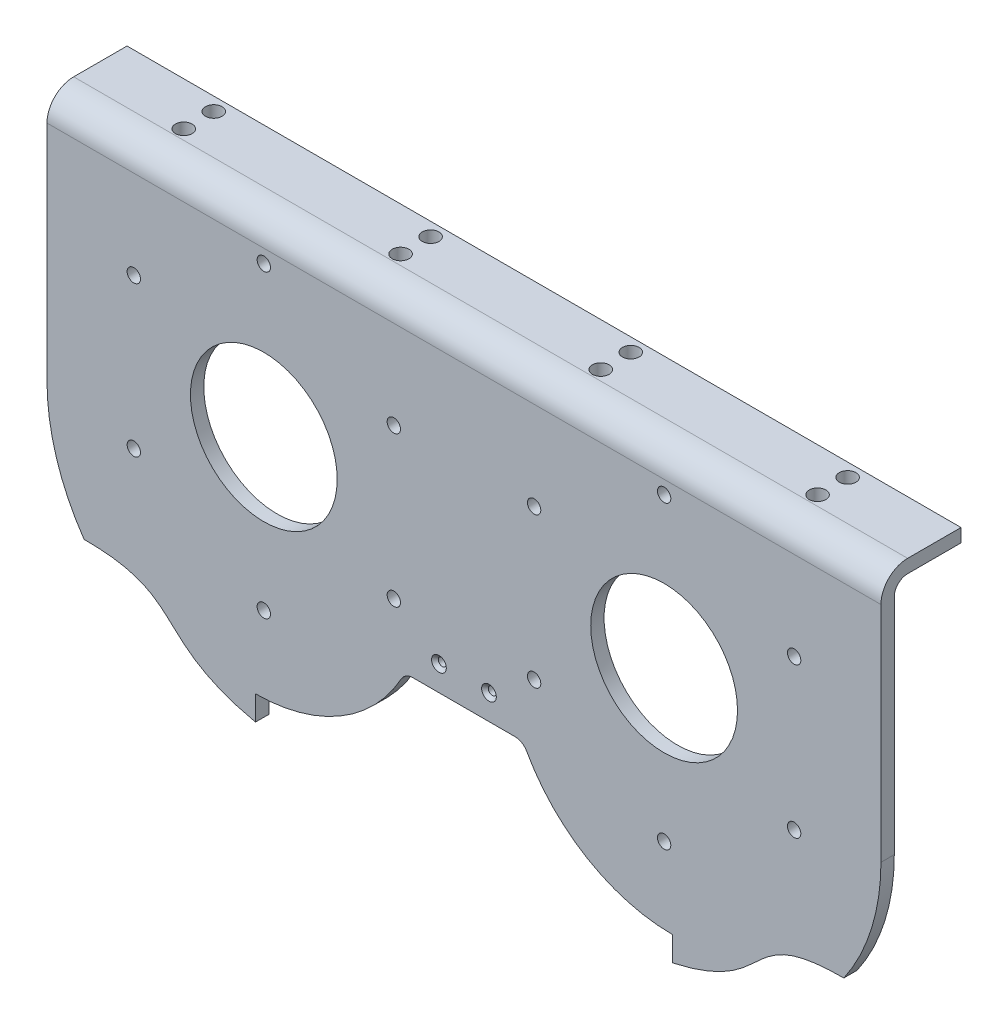
from build123d import *

# Parameters (mm, degrees)
SKETCH1_W                                           = 250
SKETCH1_H                                           = 155.2734375
BOSS_EXTRUDE1_DEPTH                                 = 4
FILLET1_R                                           = 62.5
CUT_EXTRUDE1_DEPTH                                  = 10
CUT_EXTRUDE2_DEPTH                                  = 10
SKETCH7_R                                           = 22
CUT_EXTRUDE3_DEPTH                                  = 7
SKETCH8_W                                           = 250
SKETCH8_H                                           = 19.85691045
CUT_EXTRUDE4_DEPTH                                  = 7
BOSS_EXTRUDE6_DEPTH                                 = 250
CUT_EXTRUDE6_DEPTH                                  = 250
CIRPATTERN1_COUNT                                   = 6
F_5_0_5_DIAMETER_HOLE2_AT_2_COUNT                   = 2
F_5_0_5_DIAMETER_HOLE2_AT_2_PITCH                   = 9
LPATTERN2_COUNT                                     = 2
LPATTERN2_PITCH                                     = 65
CSK_FOR_M2_COUNTERSUNK_FLAT_HEAD_SCREW1_D           = 2.4
CSK_FOR_M2_COUNTERSUNK_FLAT_HEAD_SCREW1_DEPTH       = 9
CSK_FOR_M2_COUNTERSUNK_FLAT_HEAD_SCREW1_CSINK_D     = 4.4
CSK_FOR_M2_COUNTERSUNK_FLAT_HEAD_SCREW1_CSINK_ANGLE = 90
CSK_FOR_M2_COUNTERSUNK_FLAT_HEAD_SCREW1_TIP         = 0.721032743


with BuildPart() as part:
    # Sketch1 → Boss-Extrude1 (new body)
    with BuildSketch(Plane.XY):
        with Locations((0, -2.7798083)):
            Rectangle(SKETCH1_W, SKETCH1_H)
    extrude(amount=BOSS_EXTRUDE1_DEPTH)

    # Fillet1
    fillet1_edges = [part.edges().sort_by_distance(p)[0] for p in [
        (125, -80.41652705, 2),
        (-125, -80.41652705, 2),
    ]]
    fillet(fillet1_edges, radius=FILLET1_R)

    # Sketch5 → Cut-Extrude1 (cut)
    with BuildSketch(Plane.XY.offset(4)):
        with BuildLine():
            Line((15.296531701, -40.14308955), (-15.296531701, -40.14308955))
            ThreePointArc((-15.296531701, -40.14308955), (-17.324975275, -40.695566285), (-18.793084909, -42.200381217))
            ThreePointArc((-18.793084909, -42.200381217), (-37.144455324, -61.01056787), (-62.5, -67.91652705))
            Line((-62.5, -67.91652705), (-62.5, -80.41652705))
            Line((-62.5, -80.41652705), (62.5, -80.41652705))
            Line((62.5, -80.41652705), (62.5, -67.91652705))
            ThreePointArc((62.5, -67.91652705), (37.144455324, -61.01056787), (18.793084909, -42.200381217))
            ThreePointArc((18.793084909, -42.200381217), (17.324975275, -40.695566285), (15.296531701, -40.14308955))
        make_face()
    extrude(amount=-CUT_EXTRUDE1_DEPTH, mode=Mode.SUBTRACT)

    # Sketch6 → Cut-Extrude2 (cut)
    with BuildSketch(Plane.XY.offset(4)):
        with BuildLine():
            Line((-113.871867123, -53.514016685), (-113.871867123, -84.736307966))
            Line((-113.871867123, -84.736307966), (-44.821444402, -84.736307966))
            Line((-44.821444402, -84.736307966), (-44.821444402, -77.864159797))
            add(Edge.make_bspline(
                [(-113.871867123, -53.514016685), (-77.935103041, -53.525535165), (-98.515305829, -73.080146865), (-44.821444402, -77.864159797)],
                knots=[0, 0, 0, 0, 1, 1, 1, 1], degree=3))
        make_face()
    cut_extrude2 = extrude(amount=-CUT_EXTRUDE2_DEPTH, mode=Mode.SUBTRACT)

    # Mirror2: Cut-Extrude2 across plane
    add(cut_extrude2.mirror(Plane(origin=(0, 0, 0), x_dir=(0, 0, 1), z_dir=(1, 0, 0))), mode=Mode.SUBTRACT)

    # Sketch7 → Cut-Extrude3 (cut)
    with BuildSketch(Plane.XY.offset(4)):
        with Locations((-60, 0)):
            Circle(SKETCH7_R)
    cut_extrude3 = extrude(amount=-CUT_EXTRUDE3_DEPTH, mode=Mode.SUBTRACT)

    # Mirror3: Cut-Extrude3 across plane
    add(cut_extrude3.mirror(Plane(origin=(0, 0, 0), x_dir=(0, 0, 1), z_dir=(1, 0, 0))), mode=Mode.SUBTRACT)

    # Sketch8 → Cut-Extrude4 (cut)
    with BuildSketch(Plane.XY.offset(4)):
        with Locations((0, 64.928455225)):
            Rectangle(SKETCH8_W, SKETCH8_H)
    extrude(amount=-CUT_EXTRUDE4_DEPTH, mode=Mode.SUBTRACT)

    # Sketch20 → Boss-Extrude6 (add)
    with BuildSketch(Plane.ZY.offset(125)):
        with BuildLine():
            Line((4, 45.281624312), (0, 45.281624312))
            Line((0, 45.281624312), (0, 49.00347295))
            ThreePointArc((0, 49.00347295), (-1.171572875, 51.831900074), (-4, 53.00347295))
            Line((-4, 53.00347295), (-20, 53.00347295))
            Line((-20, 53.00347295), (-20, 57.00347295))
            Line((-20, 57.00347295), (-4, 57.00347295))
            ThreePointArc((-4, 57.00347295), (1.656854249, 54.660327199), (4, 49.00347295))
            Line((4, 49.00347295), (4, 45.281624312))
        make_face()
    extrude(amount=-BOSS_EXTRUDE6_DEPTH)

    # Sketch22 → Cut-Extrude6 (cut)
    with BuildSketch(Plane.ZY.offset(125)):
        with BuildLine():
            Line((1.295437974, 55), (4, 55))
            Line((4, 55), (4, 49.00347295))
            ThreePointArc((4, 49.00347295), (3.292581977, 52.292583484), (1.295437974, 55))
        make_face()
    extrude(amount=-CUT_EXTRUDE6_DEPTH, mode=Mode.SUBTRACT)

    # Sketch3 → Ø4.0mm Dowel Hole1 (revolve, cut)
    with BuildSketch(Plane(origin=(-60, 45, 4), x_dir=(0, -1, 0), z_dir=(1, 0, 0))):
        Polygon((0, 0), (0, 51.201721238), (2, 50), (2, 0), align=None)
    f_4_0mm_dowel_hole1 = revolve(axis=Axis((-60, 45, 10.35), (0, 0, -1)), mode=Mode.SUBTRACT)

    # CirPattern1: Ø4.0mm Dowel Hole1 ×6 about axis
    cirpattern1_axis = Axis((-60, 0, 0), (0, 0, 1))
    for i in range(1, CIRPATTERN1_COUNT):
        add(f_4_0mm_dowel_hole1.rotate(cirpattern1_axis, i * 360 / CIRPATTERN1_COUNT), mode=Mode.SUBTRACT)

    # Mirror1: Ø4.0mm Dowel Hole1 across plane
    add(f_4_0mm_dowel_hole1.mirror(Plane(origin=(0, 0, 0), x_dir=(0, 0, 1), z_dir=(1, 0, 0))), mode=Mode.SUBTRACT)

    # Mirror1 copy 1 sketch → Mirror1 copy 1 (revolve, cut)
    with BuildSketch(Plane(origin=(98.97114317, 22.5, 4), x_dir=(-0.8660254037844386, -0.5000000000000001, 0), z_dir=(-0.5000000000000001, 0.8660254037844386, 0))):
        Polygon((0, 0), (0, -51.201721238), (2, -50), (2, 0), align=None)
    revolve(axis=Axis((98.97114317, 22.5, 10.35), (0, 0, 1)), mode=Mode.SUBTRACT)

    # Mirror1 copy 2 sketch → Mirror1 copy 2 (revolve, cut)
    with BuildSketch(Plane(origin=(98.97114317, -22.5, 4), x_dir=(-0.8660254037844387, 0.4999999999999998, 0), z_dir=(0.4999999999999998, 0.8660254037844387, 0))):
        Polygon((0, 0), (0, -51.201721238), (2, -50), (2, 0), align=None)
    revolve(axis=Axis((98.97114317, -22.5, 10.35), (0, 0, 1)), mode=Mode.SUBTRACT)

    # Mirror1 copy 3 sketch → Mirror1 copy 3 (revolve, cut)
    with BuildSketch(Plane(origin=(60, -45, 4), x_dir=(0, 1, 0), z_dir=(1, 0, 0))):
        Polygon((0, 0), (0, -51.201721238), (2, -50), (2, 0), align=None)
    revolve(axis=Axis((60, -45, 10.35), (0, 0, 1)), mode=Mode.SUBTRACT)

    # Mirror1 copy 4 sketch → Mirror1 copy 4 (revolve, cut)
    with BuildSketch(Plane(origin=(21.02885683, -22.5, 4), x_dir=(0.8660254037844384, 0.5000000000000004, 0), z_dir=(0.5000000000000004, -0.8660254037844384, 0))):
        Polygon((0, 0), (0, -51.201721238), (2, -50), (2, 0), align=None)
    revolve(axis=Axis((21.02885683, -22.5, 10.35), (0, 0, 1)), mode=Mode.SUBTRACT)

    # Mirror1 copy 5 sketch → Mirror1 copy 5 (revolve, cut)
    with BuildSketch(Plane(origin=(21.02885683, 22.5, 4), x_dir=(0.8660254037844386, -0.5000000000000001, 0), z_dir=(-0.5000000000000001, -0.8660254037844386, 0))):
        Polygon((0, 0), (0, -51.201721238), (2, -50), (2, 0), align=None)
    revolve(axis=Axis((21.02885683, 22.5, 10.35), (0, 0, 1)), mode=Mode.SUBTRACT)

    # Sketch24 → Ø5.0 (5) Diameter Hole2 (revolve, cut)
    with BuildSketch(Plane(origin=(-95, 57.00347295, -16), x_dir=(0, 0, 1), z_dir=(1, 0, 0))):
        Polygon((0, 0), (0, 51.502151548), (2.5, 50), (2.5, 0), align=None)
    f_5_0_5_diameter_hole2 = revolve(axis=Axis((-95, 63.35347295, -16), (0, -1, 0)), mode=Mode.SUBTRACT)

    # Ø5.0 (5) Diameter Hole2 at 2: Ø5.0 (5) Diameter Hole2 ×2
    with Locations(*[(0, 0, i * F_5_0_5_DIAMETER_HOLE2_AT_2_PITCH) for i in range(1, F_5_0_5_DIAMETER_HOLE2_AT_2_COUNT)]):
        add(f_5_0_5_diameter_hole2, mode=Mode.SUBTRACT)

    # LPattern2: Ø5.0 (5) Diameter Hole2 ×2
    with Locations(*[(i * LPATTERN2_PITCH, 0, 0) for i in range(1, LPATTERN2_COUNT)]):
        add(f_5_0_5_diameter_hole2, mode=Mode.SUBTRACT)

    # LPattern2 copy 1 sketch → LPattern2 copy 1 (revolve, cut)
    with BuildSketch(Plane(origin=(-30, 57.00347295, -7), x_dir=(0, 0, 1), z_dir=(1, 0, 0))):
        Polygon((0, 0), (0, 51.502151548), (2.5, 50), (2.5, 0), align=None)
    revolve(axis=Axis((-30, 63.35347295, -7), (0, -1, 0)), mode=Mode.SUBTRACT)

    # Mirror6: Ø5.0 (5) Diameter Hole2 across plane
    add(f_5_0_5_diameter_hole2.mirror(Plane(origin=(0, 0, 0), x_dir=(0, 0, 1), z_dir=(1, 0, 0))), mode=Mode.SUBTRACT)

    # Mirror6 copy 1 sketch → Mirror6 copy 1 (revolve, cut)
    with BuildSketch(Plane(origin=(95, 57.00347295, -7), x_dir=(0, 0, 1), z_dir=(-1, 0, 0))):
        Polygon((0, 0), (0, -51.502151548), (2.5, -50), (2.5, 0), align=None)
    revolve(axis=Axis((95, 63.35347295, -7), (0, 1, 0)), mode=Mode.SUBTRACT)

    # Mirror6 copy 2 sketch → Mirror6 copy 2 (revolve, cut)
    with BuildSketch(Plane(origin=(30, 57.00347295, -16), x_dir=(0, 0, 1), z_dir=(-1, 0, 0))):
        Polygon((0, 0), (0, -51.502151548), (2.5, -50), (2.5, 0), align=None)
    revolve(axis=Axis((30, 63.35347295, -16), (0, 1, 0)), mode=Mode.SUBTRACT)

    # Mirror6 copy 3 sketch → Mirror6 copy 3 (revolve, cut)
    with BuildSketch(Plane(origin=(30, 57.00347295, -7), x_dir=(0, 0, 1), z_dir=(-1, 0, 0))):
        Polygon((0, 0), (0, -51.502151548), (2.5, -50), (2.5, 0), align=None)
    revolve(axis=Axis((30, 63.35347295, -7), (0, 1, 0)), mode=Mode.SUBTRACT)

    # CSK for M2 Countersunk Flat Head Screw1
    with Locations(Plane.XY.offset(4)):
        with Locations((-7.5, -32.64308955), (7.5, -32.64308955)):
            CounterSinkHole(CSK_FOR_M2_COUNTERSUNK_FLAT_HEAD_SCREW1_D / 2, CSK_FOR_M2_COUNTERSUNK_FLAT_HEAD_SCREW1_CSINK_D / 2, depth=CSK_FOR_M2_COUNTERSUNK_FLAT_HEAD_SCREW1_DEPTH, counter_sink_angle=CSK_FOR_M2_COUNTERSUNK_FLAT_HEAD_SCREW1_CSINK_ANGLE)
            with Locations((0, 0, -(CSK_FOR_M2_COUNTERSUNK_FLAT_HEAD_SCREW1_DEPTH + CSK_FOR_M2_COUNTERSUNK_FLAT_HEAD_SCREW1_TIP / 2))):  # 118° drill point
                Cone(0, CSK_FOR_M2_COUNTERSUNK_FLAT_HEAD_SCREW1_D / 2, CSK_FOR_M2_COUNTERSUNK_FLAT_HEAD_SCREW1_TIP, mode=Mode.SUBTRACT)


solid = part.part
